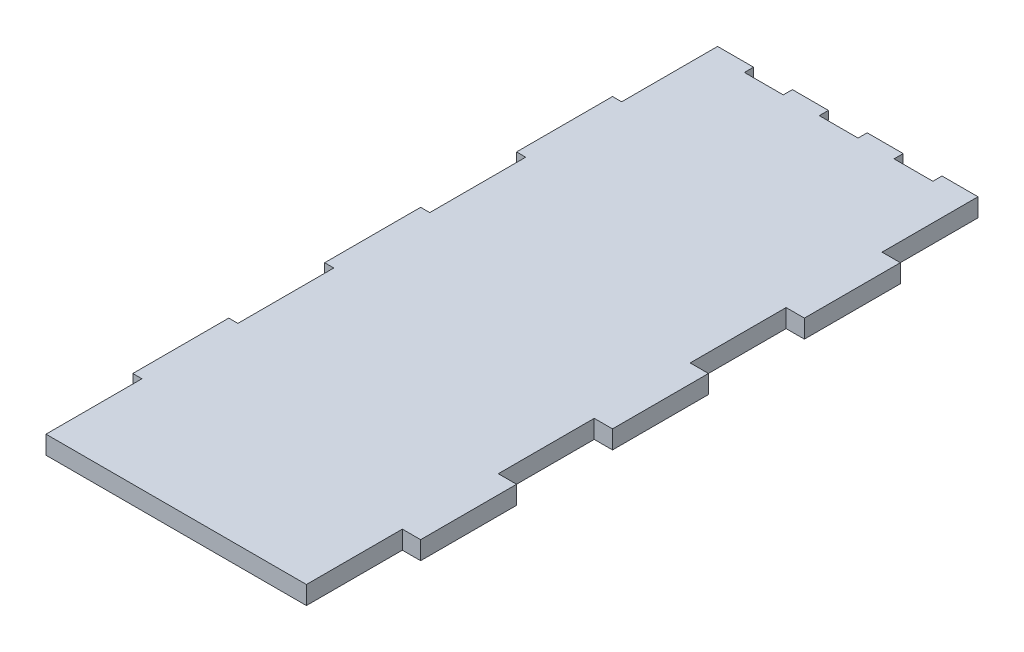
from build123d import *

# Parameters (mm, degrees)
SKETCH_4_W          = 57
SKETCH_4_H          = 145
EXTRUDE_1_DEPTH     = 4
SKETCH_5_W          = 7.875
SKETCH_5_H          = 4
EXTRUDE_2_DEPTH     = 2
SKETCH_6_W          = 21
SKETCH_6_H          = 4
EXTRUDE_3_DEPTH     = 2
EXTRUDE_START       = -57
SKETCH_6_2_W        = 21
SKETCH_6_2_H        = 4
EXTRUDE_4_DEPTH     = 4
CUT_EXTRUDE_START   = -1.8
SKETCH_7_W          = 10.3
SKETCH_7_H          = 2.2
CUT_EXTRUDE_1_DEPTH = 149.802954818
CUT_EXTRUDE_2_DEPTH = 82.310146968


with BuildPart() as part:
    # 草图4 → 凸台-拉伸1 (new body)
    with BuildSketch(Plane(origin=(0, 0, 0), x_dir=(1, 0, 0), z_dir=(0, 1, 0))):
        Rectangle(SKETCH_4_W, SKETCH_4_H)
    extrude(amount=EXTRUDE_1_DEPTH)

    # 草图5 → 凸台-拉伸2 (add)
    with BuildSketch(Plane(origin=(0, 0, -72.5), x_dir=(-1, 0, 0), z_dir=(0, 0, -1))):
        with Locations((-24.5625, 2)):
            Rectangle(SKETCH_5_W, SKETCH_5_H)
        with Locations((-8.1875, 2)):
            Rectangle(SKETCH_5_W, SKETCH_5_H)
        with Locations((8.1875, 2)):
            Rectangle(SKETCH_5_W, SKETCH_5_H)
        with Locations((24.5625, 2)):
            Rectangle(SKETCH_5_W, SKETCH_5_H)
    extrude(amount=EXTRUDE_2_DEPTH)

    # 草图6 → 凸台-拉伸3 (add)
    with BuildSketch(Plane.ZY.offset(28.5)):
        with Locations((-43, 2)):
            Rectangle(SKETCH_6_W, SKETCH_6_H)
        with Locations((-1, 2)):
            Rectangle(SKETCH_6_W, SKETCH_6_H)
        with Locations((41, 2)):
            Rectangle(SKETCH_6_W, SKETCH_6_H)
    extrude(amount=EXTRUDE_3_DEPTH)

    # 草图6<2> → 凸台-拉伸4 (add)
    with BuildSketch(Plane.ZY.offset(28.5).offset(EXTRUDE_START)):
        with Locations((-43, 2)):
            Rectangle(SKETCH_6_2_W, SKETCH_6_2_H)
        with Locations((-1, 2)):
            Rectangle(SKETCH_6_2_W, SKETCH_6_2_H)
        with Locations((41, 2)):
            Rectangle(SKETCH_6_2_W, SKETCH_6_2_H)
    extrude(amount=-EXTRUDE_4_DEPTH)

    # 草图7 → 切除-拉伸1 (cut, through all)
    with BuildSketch(Plane.XY.offset(72.5).offset(CUT_EXTRUDE_START)):
        Polygon((-10.3, 2.2), (-10.3, 0), (-12.5, 2.2), align=None)
        with Locations((-5.15, 1.1)):
            Rectangle(SKETCH_7_W, SKETCH_7_H)
        with Locations((5.15, 1.1)):
            Rectangle(SKETCH_7_W, SKETCH_7_H)
        Polygon((10.3, 2.2), (12.5, 2.2), (10.3, 0), align=None)
    extrude(amount=-CUT_EXTRUDE_1_DEPTH, mode=Mode.SUBTRACT)

    # 草图8 → 切除-拉伸2 (cut, through all)
    with BuildSketch(Plane.XZ.offset(-2.2)):
        Polygon((-12.5, -61.018518519), (-16.375, -72.5), (-12.5, -72.5), align=None)
        Polygon((-10.3, -54.5), (-12.5, -61.018518519), (-12.5, -72.5), (-12.125, -72.5), (-4.25, -72.5), (4.25, -72.5), (12.125, -72.5), (12.5, -72.5), (12.5, -61.018518519), (10.3, -54.5), align=None)
        Polygon((12.5, -72.5), (16.375, -72.5), (12.5, -61.018518519), align=None)
    extrude(amount=CUT_EXTRUDE_2_DEPTH, mode=Mode.SUBTRACT)


with BuildPart() as cut_extrude_2_kept_piece:
    # of the separate pieces the step leaves, the one the design keeps (cut_extrude_2_pieces_kept)
    add(part.part.solids().sort_by_distance((-28.5, 0, 72.5))[0])


solid = cut_extrude_2_kept_piece.part
